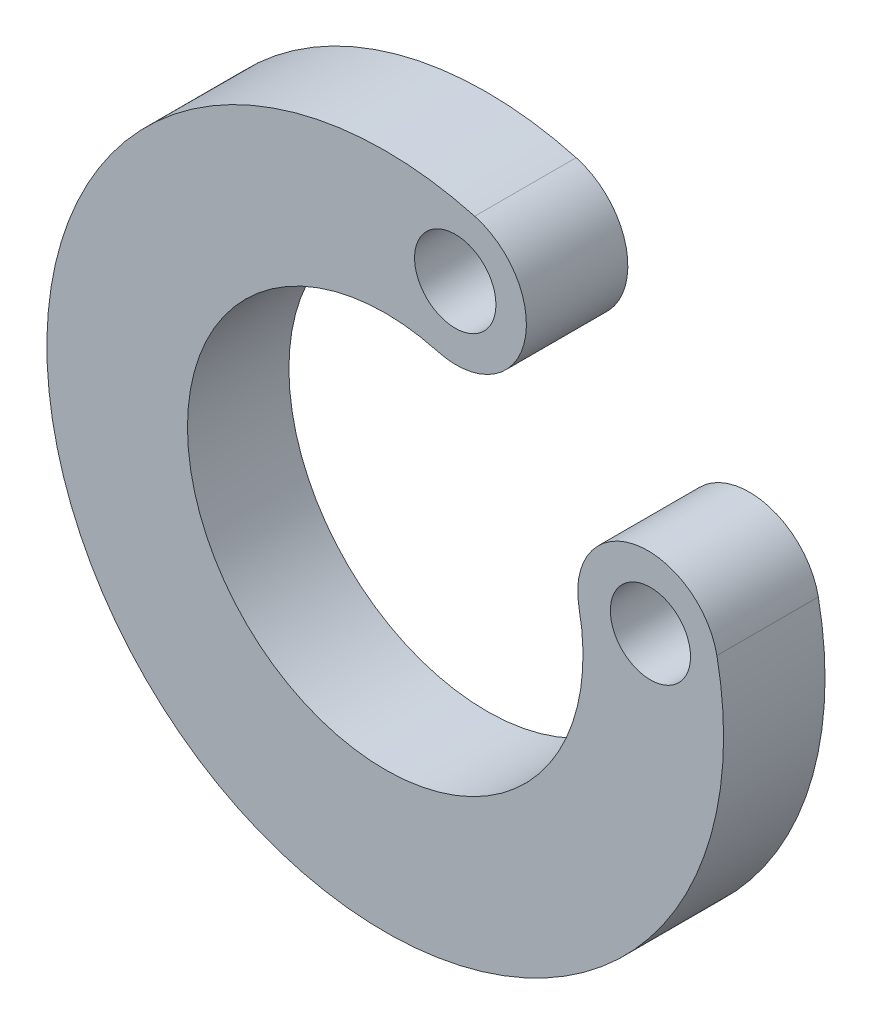
from build123d import *

# Parameters (mm, degrees)
BOSS_EXTRUDE1_DEPTH = 10
SKETCH2_R           = 4.010526774
SKETCH2_R_2         = 3.950911994
CUT_EXTRUDE2_DEPTH  = 10


with BuildPart() as part:
    # Sketch1 → Boss-Extrude1 (new body)
    with BuildSketch(Plane.XY):
        with BuildLine():
            ThreePointArc((-33.989040517, 36.142816718), (-67.185323929, -18.789245764), (-10.11434169, 10.577873726))
            ThreePointArc((-10.11434169, 10.577873726), (-18.277756389, 15.998303864), (-23.698186527, 7.834889164))
            ThreePointArc((-23.698186527, 7.834889164), (-57.057127067, -9.330681752), (-37.653346002, 22.778024532))
            ThreePointArc((-37.653346002, 22.778024532), (-29.138797167, 27.628267882), (-33.989040517, 36.142816718))
        make_face()
    extrude(amount=BOSS_EXTRUDE1_DEPTH)

    # Sketch2 → Cut-Extrude2 (cut)
    with BuildSketch(Plane.XY.offset(10)):
        with Locations((-35.907207797, 29.632235542)):
            Circle(SKETCH2_R)
        with Locations((-16.665002101, 9.172168726)):
            Circle(SKETCH2_R_2)
    extrude(amount=-CUT_EXTRUDE2_DEPTH, mode=Mode.SUBTRACT)


solid = part.part
